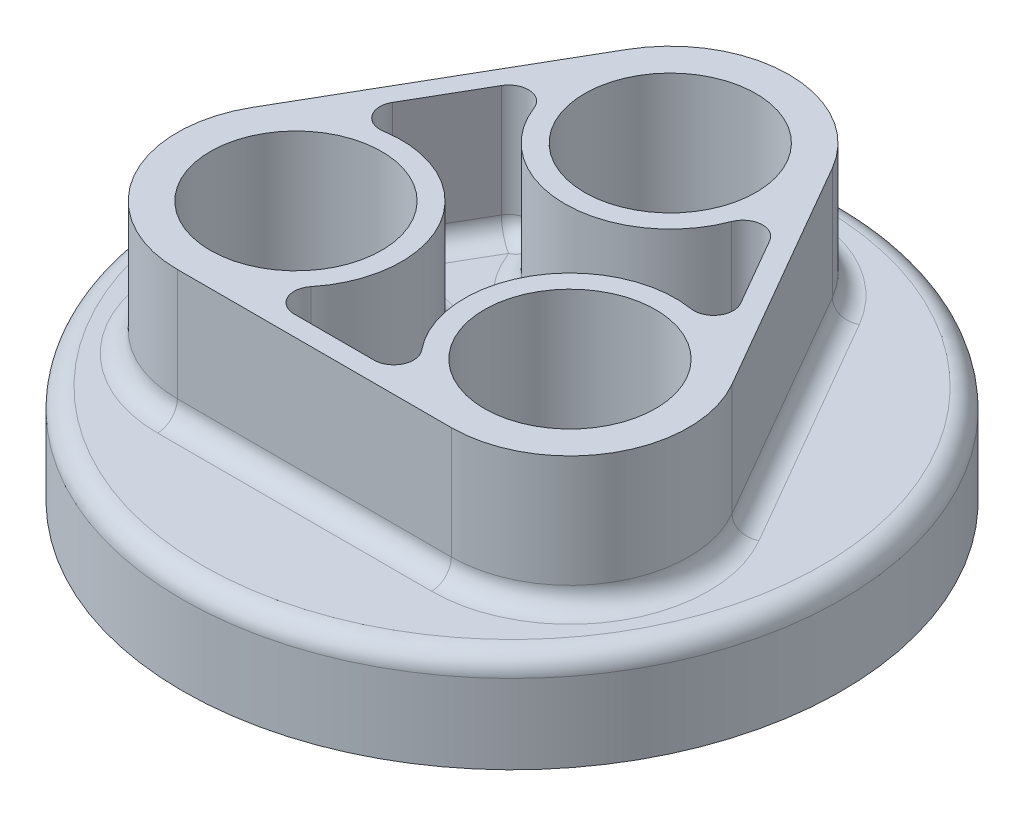
from build123d import *

# Parameters (mm, degrees)
SKETCH1_R           = 50
BOSS_EXTRUDE1_DEPTH = 15
SHELL1_T            = -3
SKETCH2_R           = 13
BOSS_EXTRUDE2_DEPTH = 20
SKETCH2_2_R         = 13
CUT_EXTRUDE1_DEPTH  = 74.484692283
BOSS_EXTRUDE3_START = 12
SKETCH3_R           = 16
SKETCH3_R_2         = 13
BOSS_EXTRUDE3_DEPTH = 12
FILLET1_R           = 3


with BuildPart() as part:
    # Sketch1 → Boss-Extrude1 (new body)
    with BuildSketch(Plane(origin=(0, 0, 0), x_dir=(1, 0, 0), z_dir=(0, 1, 0))):
        with Locations(Location((0, 0, 0), (0, 0, 270))):
            Circle(SKETCH1_R)
    extrude(amount=BOSS_EXTRUDE1_DEPTH)

    # Shell1
    shell1_openings = [part.faces().sort_by_distance(p)[0] for p in [
        (0, 0, 0),
    ]]
    offset(amount=SHELL1_T, openings=shell1_openings, kind=Kind.INTERSECTION)

    # Sketch2 → Boss-Extrude2 (add)
    with BuildSketch(Plane(origin=(0, 15, 0), x_dir=(1, 0, 0), z_dir=(0, 1, 0))):
        with BuildLine():
            Line((-15.588457268, 33), (-36.373066959, -3))
            ThreePointArc((-36.373066959, -3), (-36.373066959, -21), (-20.784609691, -30))
            Line((-20.784609691, -30), (20.784609691, -30))
            ThreePointArc((20.784609691, -30), (36.373066959, -21), (36.373066959, -3))
            Line((36.373066959, -3), (15.588457268, 33))
            ThreePointArc((15.588457268, 33), (0, 42), (-15.588457268, 33))
        make_face()
        with Locations(Location((0, 24, 0), (0, 0, 270))):
            Circle(SKETCH2_R, mode=Mode.SUBTRACT)
        with Locations(Location((20.784609691, -12, 0), (0, 0, 270))):
            Circle(SKETCH2_R, mode=Mode.SUBTRACT)
        with Locations(Location((-20.784609691, -12, 0), (0, 0, 270))):
            Circle(SKETCH2_R, mode=Mode.SUBTRACT)
        with BuildLine():
            Line((-20.355840988, 18.742649178), (-26.409530816, 8.257350822))
            ThreePointArc((-26.409530816, 8.257350822), (-26.281358489, 5.054537032), (-23.333531724, 3.79566385))
            ThreePointArc((-23.333531724, 3.79566385), (-6.92820323, -4), (-8.379624543, -22.105263158))
            ThreePointArc((-8.379624543, -22.105263158), (-8.763321771, -25.287592613), (-6.053689828, -27))
            Line((-6.053689828, -27), (6.053689828, -27))
            ThreePointArc((6.053689828, -27), (8.763321771, -25.287592613), (8.379624543, -22.105263158))
            ThreePointArc((8.379624543, -22.105263158), (6.92820323, -4), (23.333531724, 3.79566385))
            ThreePointArc((23.333531724, 3.79566385), (26.281358489, 5.054537032), (26.409530816, 8.257350822))
            Line((26.409530816, 8.257350822), (20.355840988, 18.742649178))
            ThreePointArc((20.355840988, 18.742649178), (17.518036718, 20.233055581), (14.95390718, 18.309599308))
            ThreePointArc((14.95390718, 18.309599308), (0, 8), (-14.95390718, 18.309599308))
            ThreePointArc((-14.95390718, 18.309599308), (-17.518036718, 20.233055581), (-20.355840988, 18.742649178))
        make_face(mode=Mode.SUBTRACT)
    extrude(amount=BOSS_EXTRUDE2_DEPTH)

    # Sketch2<2> → Cut-Extrude1 (cut, through all)
    with BuildSketch(Plane(origin=(0, 15, 0), x_dir=(1, 0, 0), z_dir=(0, 1, 0))):
        with Locations(Location((-20.784609691, -12, 0), (0, 0, 270))):
            Circle(SKETCH2_2_R)
        with Locations(Location((0, 24, 0), (0, 0, 270))):
            Circle(SKETCH2_2_R)
        with Locations(Location((20.784609691, -12, 0), (0, 0, 270))):
            Circle(SKETCH2_2_R)
    extrude(amount=-CUT_EXTRUDE1_DEPTH, mode=Mode.SUBTRACT)

    # Sketch3 → Boss-Extrude3 (add)
    # profile 1 of 3: a face of its own
    with BuildSketch(Plane.XZ.offset(-12).offset(BOSS_EXTRUDE3_START)):
        with Locations(Location((-20.784609691, 12, 0), (0, 0, 90))):
            Circle(SKETCH3_R)
        with Locations(Location((-20.784609691, 12, 0), (0, 0, 90))):
            Circle(SKETCH3_R_2, mode=Mode.SUBTRACT)
    # profile 2 of 3: a face of its own
    with BuildSketch(Plane.XZ.offset(-12).offset(BOSS_EXTRUDE3_START)):
        with Locations(Location((20.784609691, 12, 0), (0, 0, 90))):
            Circle(SKETCH3_R)
        with Locations(Location((20.784609691, 12, 0), (0, 0, 90))):
            Circle(SKETCH3_R_2, mode=Mode.SUBTRACT)
    # profile 3 of 3: a face of its own
    with BuildSketch(Plane.XZ.offset(-12).offset(BOSS_EXTRUDE3_START)):
        with Locations(Location((0, -24, 0), (0, 0, 90))):
            Circle(SKETCH3_R)
        with Locations(Location((0, -24, 0), (0, 0, 90))):
            Circle(SKETCH3_R_2, mode=Mode.SUBTRACT)
    extrude(amount=-BOSS_EXTRUDE3_DEPTH)

    # Fillet1
    fillet1_edges = [part.edges().sort_by_distance(p)[0] for p in [
        (-6.92820323, 15, 4),
        (-8.763321771, 15, 25.287592613),
        (0, 15, 27),
        (8.763321771, 15, 25.287592613),
        (6.92820323, 15, 4),
        (26.281358489, 15, -5.054537032),
        (23.382685902, 15, -13.5),
        (17.518036718, 15, -20.233055581),
        (0, 15, -8),
        (-17.518036718, 15, -20.233055581),
        (-23.382685902, 15, -13.5),
        (-26.281358489, 15, -5.054537032),
        (36.373066959, 15, 21),
        (25.980762114, 15, -15),
        (0, 15, -42),
        (-25.980762114, 15, -15),
        (-36.373066959, 15, 21),
        (0, 15, 30),
        (0, 15, -50),
        (0, 12, -47),
        (-20.784609691, 12, -4),
        (20.784609691, 12, -4),
        (0, 12, -40),
    ]]
    fillet(fillet1_edges, radius=FILLET1_R)


solid = part.part
